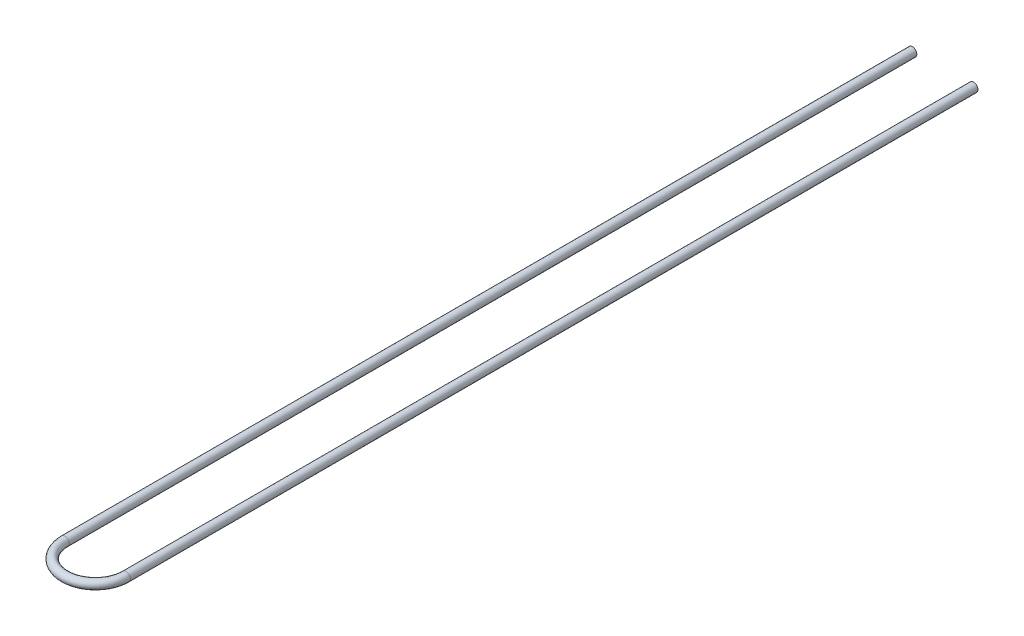
from build123d import *

# Parameters (mm, degrees)
SKETCH2_R   = 11.1
SKETCH2_R_2 = 9.95


with BuildPart() as part:
    # Sweep1: sweep along a path in Sketch1
    with BuildLine(Plane(origin=(0, 0, 0), x_dir=(1, 0, 0), z_dir=(0, 1, 0))) as sweep1_path:
        Line((114.46, -300), (114.46, -2440))
        ThreePointArc((114.46, -2440), (37.23, -2517.23), (-40, -2440))
        Line((-40, -2440), (-40, -300))
    # Sketch2 → Sweep1 (sweep)
    with BuildSketch(Plane(origin=(114.46, 0, 300), x_dir=(-1, 0, 0), z_dir=(0, 0, -1))):
        Circle(SKETCH2_R)
        Circle(SKETCH2_R_2, mode=Mode.SUBTRACT)
    sweep(path=sweep1_path.line)


solid = part.part
